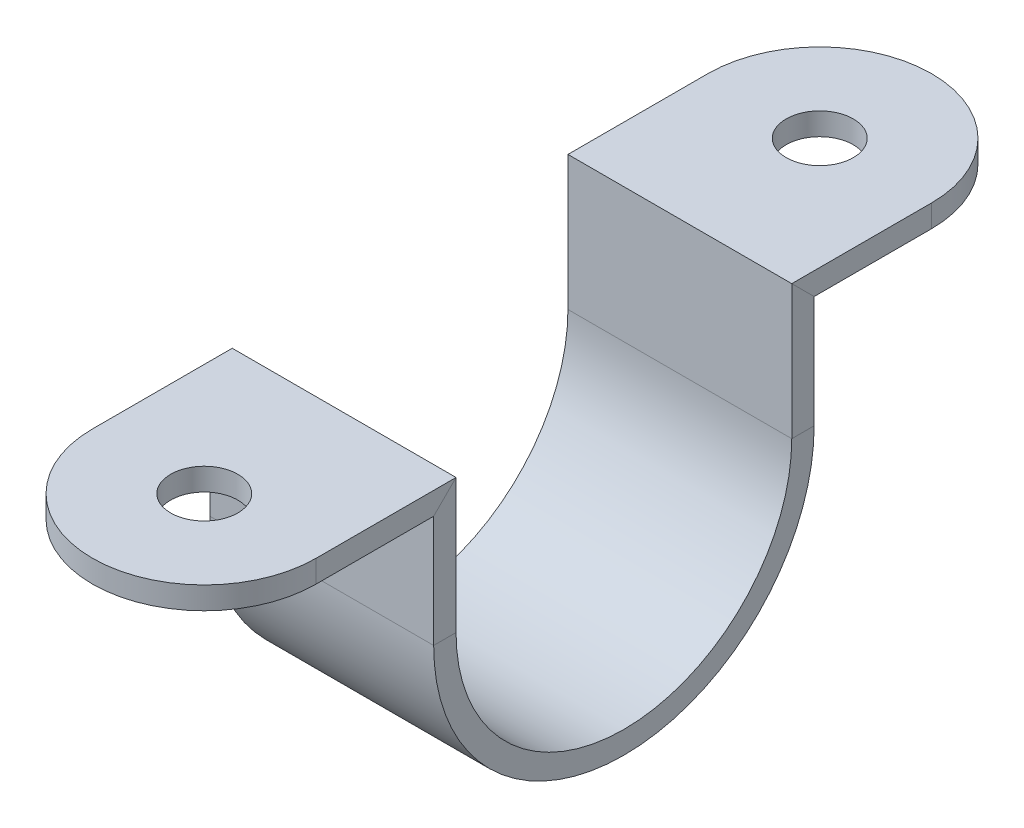
from build123d import *

# Parameters (mm, degrees)
SKETCH2_W               = 10
SKETCH2_H               = 1
FILLET3_RADIUS          = 5
FILLET3_LENGTH          = 1
FILLET4_RADIUS          = 5
FILLET4_LENGTH          = 1
CUT_EXTRUDE1_DEPTH      = 41.51542916
CUT_EXTRUDE1_DEPTH_BACK = 41.51542916
SKETCH3_R               = 1.5


with BuildPart() as part:
    # Sweep1: sweep along a path in Sketch1
    with BuildLine(Plane(origin=(0, 0, 0), x_dir=(0, 0, -1), z_dir=(1, 0, 0))) as sweep1_path:
        Line((0, 0), (11.25, 0))
        Line((11.25, 0), (11.25, -6))
        ThreePointArc((11.25, -6), (18.75, -13.5), (26.25, -6))
        Line((26.25, -6), (26.25, 0))
        Line((26.25, 0), (37.5, 0))
    # Sketch2 → Sweep1 (sweep)
    with BuildSketch(Plane.XY):
        with Locations((0, -0.5)):
            Rectangle(SKETCH2_W, SKETCH2_H)
    sweep(path=sweep1_path.line, transition=Transition.RIGHT)

    # Fillet3: full round fillet: the end face becomes a half cylinder, R = half its width
    fillet3_face = Plane((0, -0.5, 0), x_dir=(0, -1, 0), z_dir=(0, 0, 1))  # on the end face: x along it, z out of the body
    fillet3_slab = fillet3_face.offset(-FILLET3_RADIUS / 2) * Box(FILLET3_LENGTH, 2 * FILLET3_RADIUS, FILLET3_RADIUS, mode=Mode.PRIVATE)  # the body's end, R deep
    fillet3_round = Plane((0, -0.5, -5), x_dir=(0, 0, 1), z_dir=(0, -1, 0)) * Cylinder(FILLET3_RADIUS, FILLET3_LENGTH, mode=Mode.PRIVATE)  # its axis R under the face
    add(fillet3_slab - fillet3_round, mode=Mode.SUBTRACT)

    # Fillet4: full round fillet: the end face becomes a half cylinder, R = half its width
    fillet4_face = Plane((0, -0.5, -37.5), x_dir=(0, 1, 0), z_dir=(0, 0, -1))  # on the end face: x along it, z out of the body
    fillet4_slab = fillet4_face.offset(-FILLET4_RADIUS / 2) * Box(FILLET4_LENGTH, 2 * FILLET4_RADIUS, FILLET4_RADIUS, mode=Mode.PRIVATE)  # the body's end, R deep
    fillet4_round = Plane((0, -0.5, -32.5), x_dir=(0, 0, -1), z_dir=(0, 1, 0)) * Cylinder(FILLET4_RADIUS, FILLET4_LENGTH, mode=Mode.PRIVATE)  # its axis R under the face
    add(fillet4_slab - fillet4_round, mode=Mode.SUBTRACT)

    # Sketch3 → Cut-Extrude1 (cut, two sides: drawn at the far end of the back side and taken through both)
    with BuildSketch(Plane(origin=(0, 0, 0), x_dir=(1, 0, 0), z_dir=(0, 1, 0)).offset(-CUT_EXTRUDE1_DEPTH_BACK)):
        with Locations(Location((0, 5, 0), (0, 0, 270))):
            Circle(SKETCH3_R)
        with Locations(Location((0, 32.5, 0), (0, 0, 270))):
            Circle(SKETCH3_R)
    extrude(amount=CUT_EXTRUDE1_DEPTH + CUT_EXTRUDE1_DEPTH_BACK, mode=Mode.SUBTRACT)


solid = part.part
